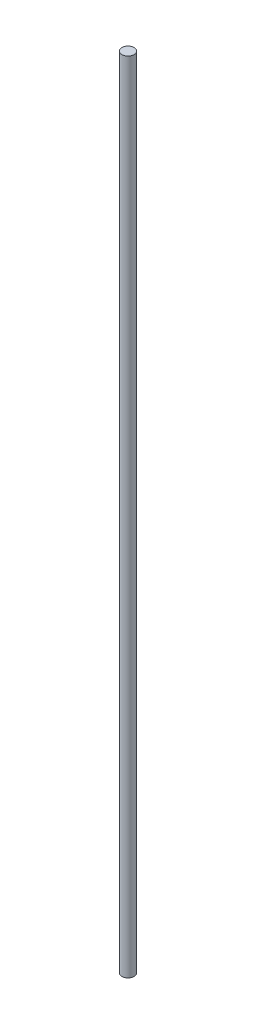
from build123d import *

# Parameters (mm, degrees)
SKETCH1_R           = 1
BOSS_EXTRUDE1_DEPTH = 130


with BuildPart() as part:
    # Sketch1 → Boss-Extrude1 (new body)
    with BuildSketch(Plane(origin=(0, 0, 0), x_dir=(1, 0, 0), z_dir=(0, 1, 0))):
        with Locations(Location((0, 0, 0), (0, 0, 270))):
            Circle(SKETCH1_R)
    extrude(amount=BOSS_EXTRUDE1_DEPTH)


solid = part.part
